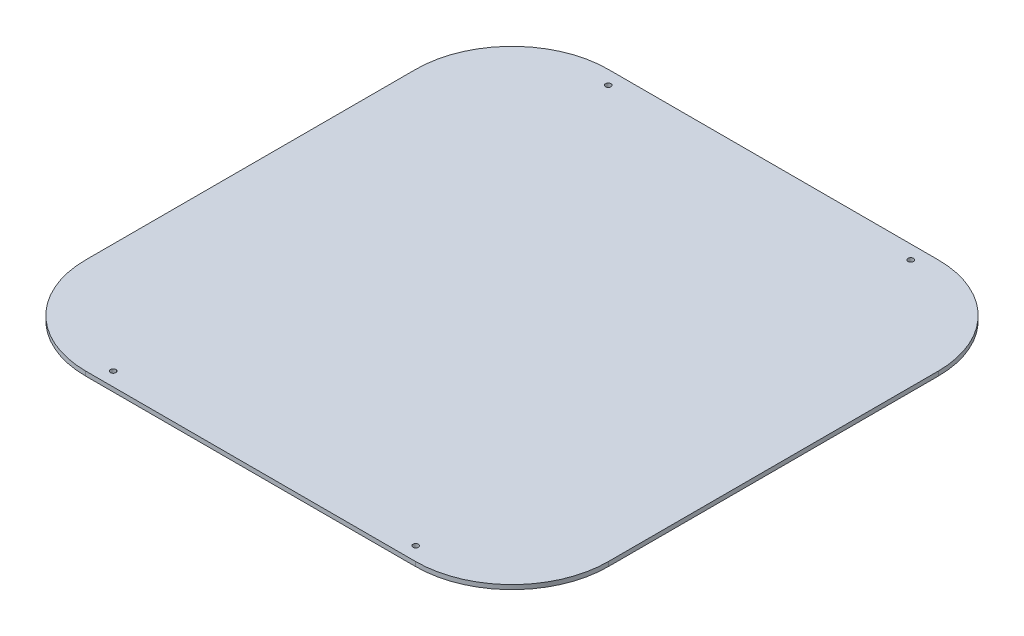
from build123d import *

# Parameters (mm, degrees)
ESBO_O1_W                = 190
ESBO_O1_H                = 190
RESSALTO_EXTRUS_O1_DEPTH = 1.6
FILETE1_R                = 35
ESBO_O2_R                = 1
CORTE_EXTRUS_O1_DEPTH    = 135.359815421


with BuildPart() as part:
    # Esboço1 → Ressalto-extrusão1 (new body)
    with BuildSketch(Plane(origin=(0, 0, 0), x_dir=(1, 0, 0), z_dir=(0, 1, 0))):
        Rectangle(ESBO_O1_W, ESBO_O1_H)
    extrude(amount=RESSALTO_EXTRUS_O1_DEPTH)

    # Filete1
    filete1_edges = [part.edges().sort_by_distance(p)[0] for p in [
        (95, 0.8, 95),
        (-95, 0.8, 95),
        (-95, 0.8, -95),
        (95, 0.8, -95),
    ]]
    fillet(filete1_edges, radius=FILETE1_R)

    # Esboço2 → Corte-extrusão1 (cut, through all)
    with BuildSketch(Plane(origin=(0, 1.6, 0), x_dir=(1, 0, 0), z_dir=(0, 1, 0))):
        with Locations(Location((-55, 90, 0), (0, 0, 270))):
            Circle(ESBO_O2_R)
        with Locations(Location((55, 90, 0), (0, 0, 90))):
            Circle(ESBO_O2_R)
        with Locations(Location((55, -90, 0), (0, 0, 270))):
            Circle(ESBO_O2_R)
        with Locations(Location((-55, -90, 0), (0, 0, 90))):
            Circle(ESBO_O2_R)
    extrude(amount=-CORTE_EXTRUS_O1_DEPTH, mode=Mode.SUBTRACT)


solid = part.part
